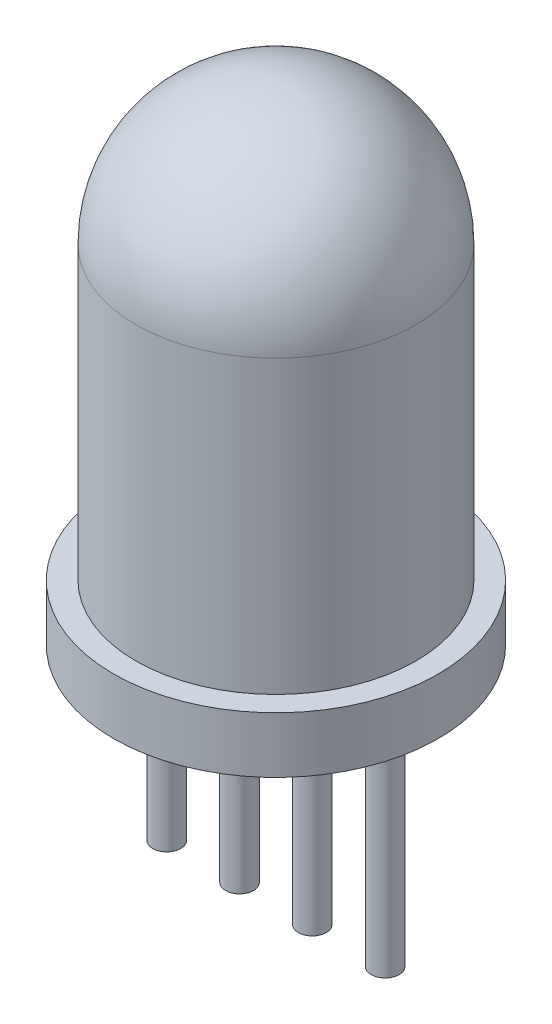
from build123d import *

# Parameters (mm, degrees)
SKETCH2_R           = 0.25
BOSS_EXTRUDE1_DEPTH = 4


with BuildPart() as part:
    # Sketch1 → Revolve1 (revolve)
    with BuildSketch(Plane(origin=(0, 0, 0), x_dir=(0, 0, -1), z_dir=(1, 0, 0))):
        with BuildLine():
            Line((-2.5, 6.2), (-2.5, 1))
            Line((-2.5, 1), (-2.9, 1))
            Line((-2.9, 1), (-2.9, 0))
            Line((-2.9, 0), (0, 0))
            Line((0, 0), (0, 8.7))
            ThreePointArc((0, 8.7), (-1.767766953, 7.967766953), (-2.5, 6.2))
        make_face()
    revolve(axis=Axis((0, 16.477597325, 0), (0, -1, 0)))

    # Sketch2 → Boss-Extrude1 (add)
    with BuildSketch(Plane.XZ):
        with Locations(Location((-1.95, 0, 0), (0, 0, 270))):
            Circle(SKETCH2_R)
        with Locations(Location((-0.65, 0, 0), (0, 0, 270))):
            Circle(SKETCH2_R)
        with Locations(Location((0.65, 0, 0), (0, 0, 90))):
            Circle(SKETCH2_R)
        with Locations(Location((1.95, 0, 0), (0, 0, 90))):
            Circle(SKETCH2_R)
    extrude(amount=BOSS_EXTRUDE1_DEPTH)


solid = part.part
